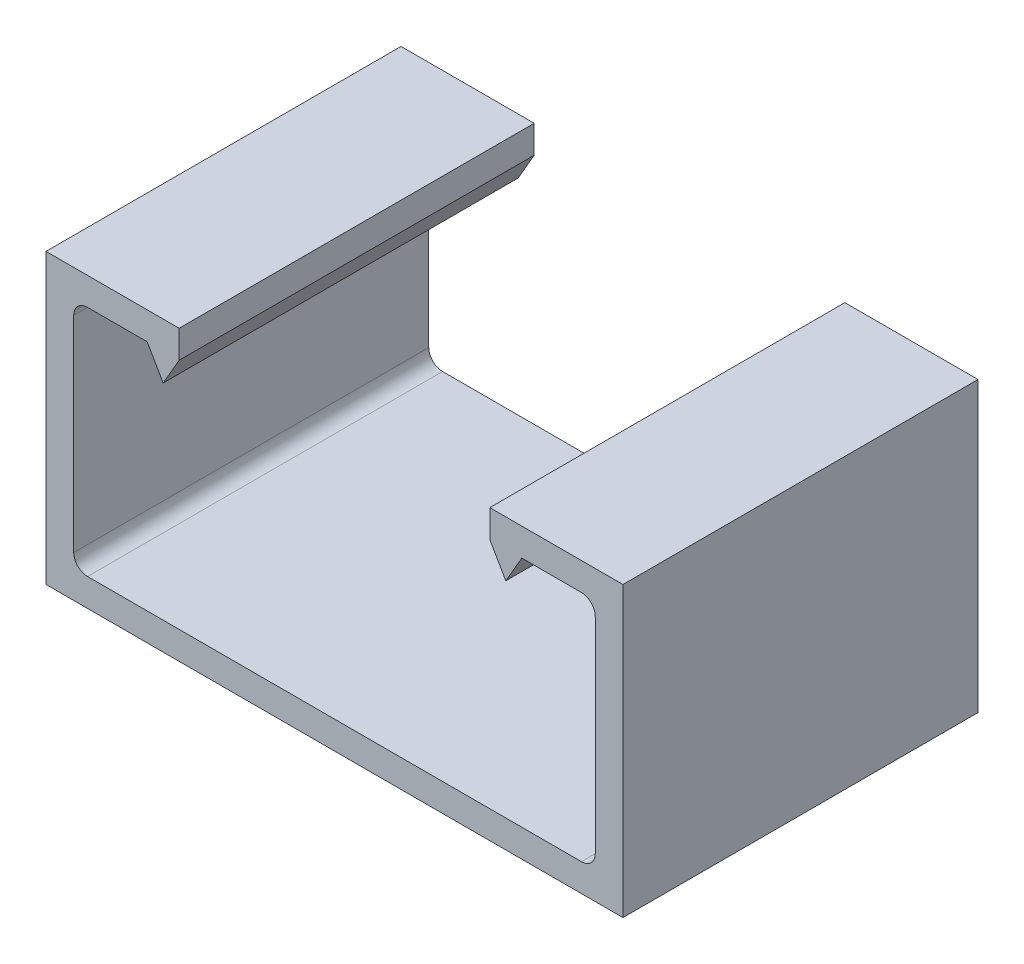
from build123d import *

# Parameters (mm, degrees)
BASE_EXTRUDE_DEPTH = 12.7


with BuildPart() as part:
    # Sketch1 → Base-Extrude (new, symmetric)
    with BuildSketch(Plane.XY):
        with BuildLine():
            Line((-11.1125, 10.31875), (-20.6375, 10.31875))
            Line((-20.6375, 10.31875), (-20.6375, -10.31875))
            Line((-20.6375, -10.31875), (20.6375, -10.31875))
            Line((20.6375, -10.31875), (20.6375, 10.31875))
            Line((20.6375, 10.31875), (11.1125, 10.31875))
            Line((11.1125, 10.31875), (11.1125, 8.33755))
            Line((11.1125, 8.33755), (12.256346355, 6.35635))
            Line((12.256346355, 6.35635), (13.400192707, 8.33755))
            Line((13.400192707, 8.33755), (17.6657, 8.33755))
            ThreePointArc((17.6657, 8.33755), (18.366159977, 8.047409977), (18.6563, 7.34695))
            Line((18.6563, 7.34695), (18.6563, -7.34695))
            ThreePointArc((18.6563, -7.34695), (18.366159977, -8.047409977), (17.6657, -8.33755))
            Line((17.6657, -8.33755), (-17.6657, -8.33755))
            ThreePointArc((-17.6657, -8.33755), (-18.366159977, -8.047409977), (-18.6563, -7.34695))
            Line((-18.6563, -7.34695), (-18.6563, 7.34695))
            ThreePointArc((-18.6563, 7.34695), (-18.366159977, 8.047409977), (-17.6657, 8.33755))
            Line((-17.6657, 8.33755), (-13.400192707, 8.33755))
            Line((-13.400192707, 8.33755), (-12.256346355, 6.35635))
            Line((-12.256346355, 6.35635), (-11.1125, 8.33755))
            Line((-11.1125, 8.33755), (-11.1125, 10.31875))
        make_face()
    extrude(amount=BASE_EXTRUDE_DEPTH, both=True)


solid = part.part
